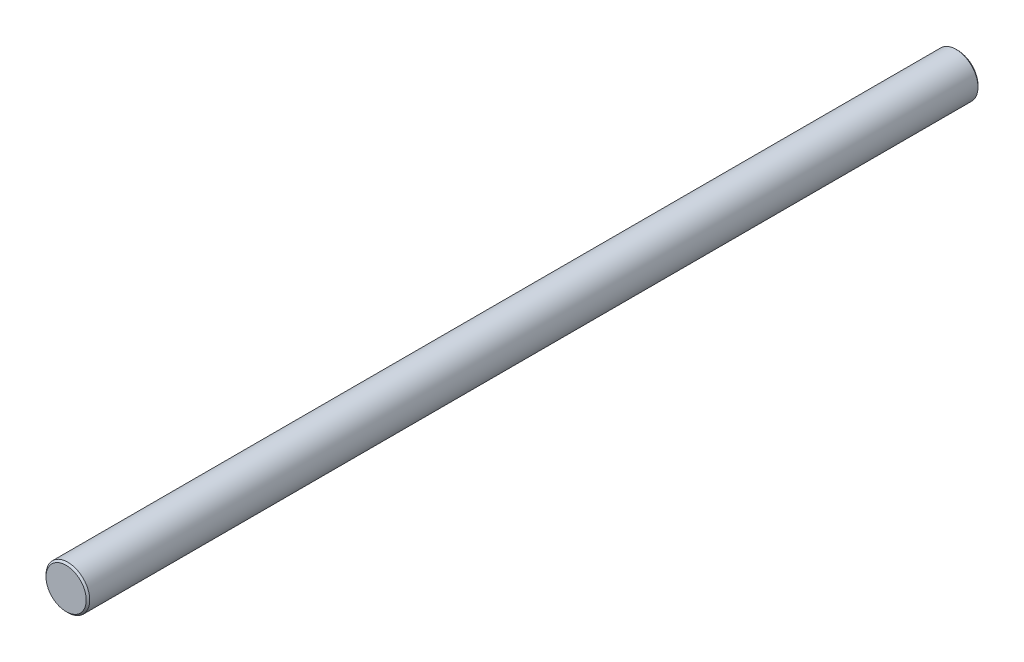
from build123d import *

# Parameters (mm, degrees)
SKETCH_1_R      = 12.5
EXTRUDE_1_DEPTH = 255
CHAMFER_1_SIZE  = 1


with BuildPart() as part:
    # Эскиз1 → Бобышка-Вытянуть1 (new, symmetric)
    with BuildSketch(Plane.XY):
        Circle(SKETCH_1_R)
    extrude(amount=EXTRUDE_1_DEPTH, both=True)

    # Фаска1
    chamfer_1_edges = [part.edges().sort_by_distance(p)[0] for p in [
        (-12.5, 0, -255),
        (-12.5, 0, 255),
    ]]
    chamfer(chamfer_1_edges, length=CHAMFER_1_SIZE)


solid = part.part
